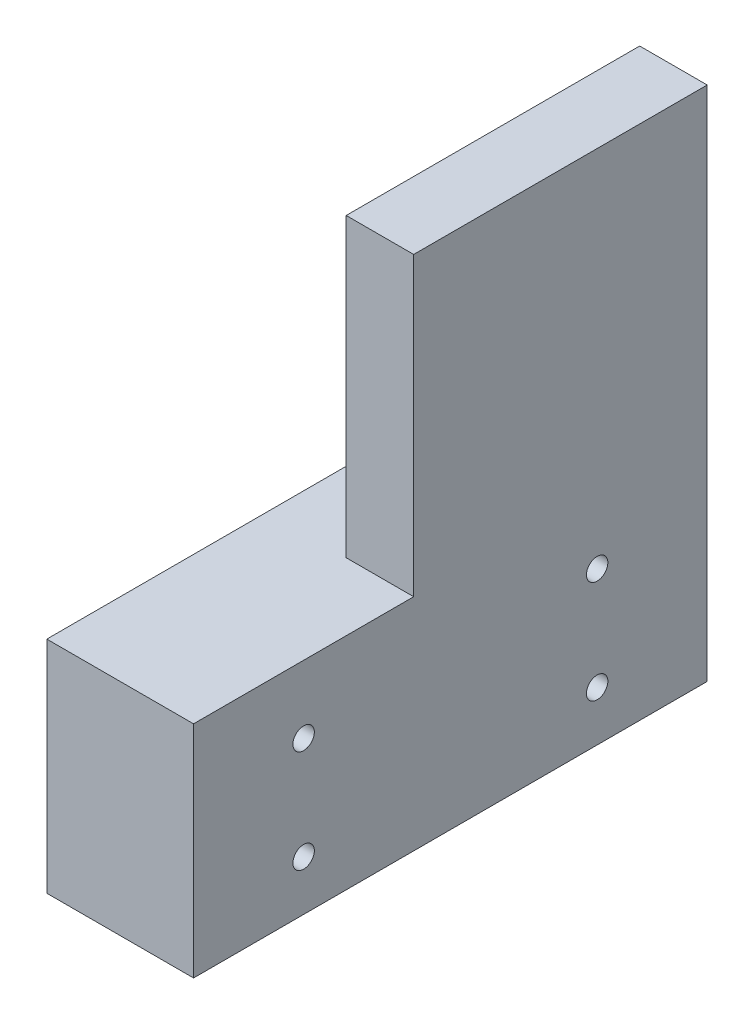
from build123d import *

# Parameters (mm, degrees)
SKETCH1_W           = 44.45
SKETCH1_H           = 19.05
BOSS_EXTRUDE1_DEPTH = 12.7
SKETCH3_R           = 0.927000051
CUT_EXTRUDE1_DEPTH  = 50.99995
SKETCH4_W           = 5.842
SKETCH4_H           = 25.4
BOSS_EXTRUDE2_DEPTH = 25.654


with BuildPart() as part:
    # Sketch1 → Boss-Extrude1 (new body)
    with BuildSketch(Plane(origin=(0, 0, 0), x_dir=(0, 0, -1), z_dir=(1, 0, 0))):
        with Locations((22.225, 9.525)):
            Rectangle(SKETCH1_W, SKETCH1_H)
    extrude(amount=BOSS_EXTRUDE1_DEPTH)

    # Sketch3 → Cut-Extrude1 (cut, through all)
    with BuildSketch(Plane(origin=(0, 0, 0), x_dir=(0, 0, -1), z_dir=(1, 0, 0))):
        with Locations((9.525, 4.318)):
            Circle(SKETCH3_R)
        with Locations((34.925, 4.318)):
            Circle(SKETCH3_R)
        with Locations((34.925, 13.208)):
            Circle(SKETCH3_R)
        with Locations((9.525, 13.208)):
            Circle(SKETCH3_R)
    extrude(amount=CUT_EXTRUDE1_DEPTH, mode=Mode.SUBTRACT)

    # Sketch4 → Boss-Extrude2 (add)
    with BuildSketch(Plane(origin=(0, 19.05, 0), x_dir=(1, 0, 0), z_dir=(0, 1, 0))):
        with Locations((9.779, 31.75)):
            Rectangle(SKETCH4_W, SKETCH4_H)
    extrude(amount=BOSS_EXTRUDE2_DEPTH)


solid = part.part
